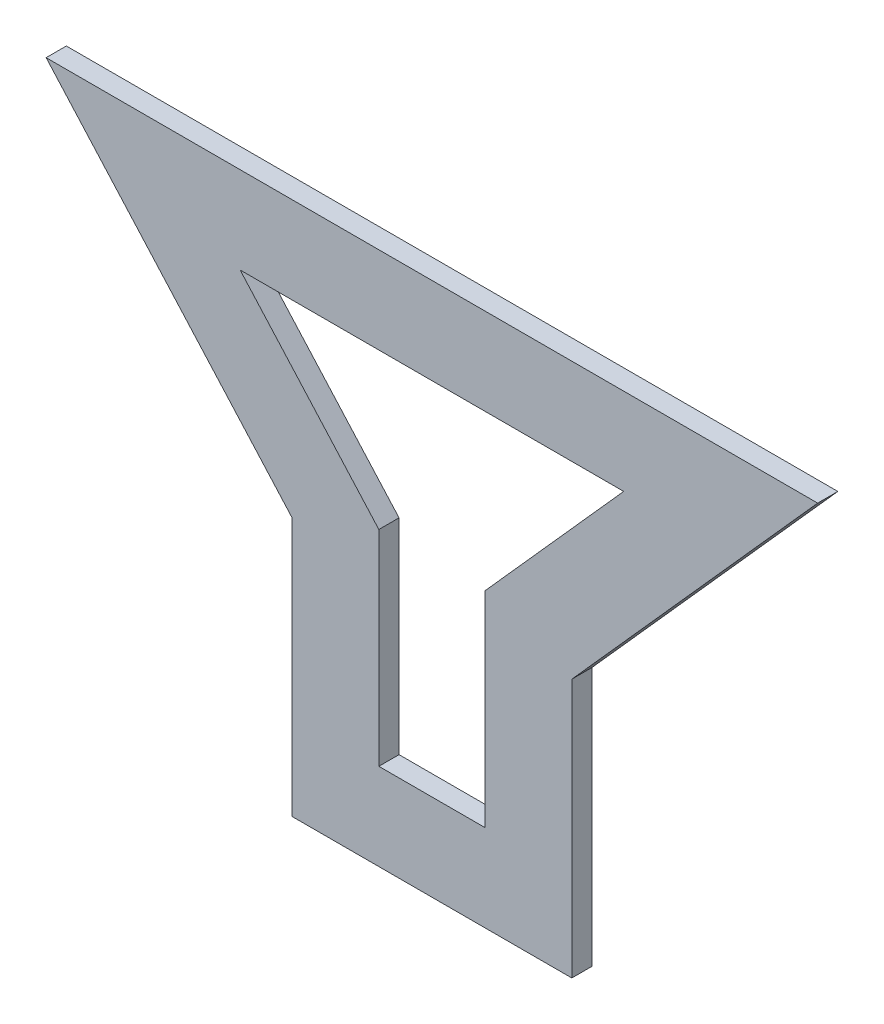
from build123d import *

# Parameters (mm, degrees)
EXTRUDE_2_DEPTH = 10


with BuildPart() as part:
    # Эскиз5 → Бобышка-Вытянуть2 (new body)
    with BuildSketch(Plane.XY):
        Polygon((69.270264014, 2.532805315), (69.270264014, -125.60178411), (-69.270264014, -125.60178411), (-69.270264014, 2.532805315), (-190.995381487, 138.884340659), (190.995381487, 138.884340659), align=None)
        Polygon((-26.270264014, -82.60178411), (26.270264014, -82.60178411), (26.270264014, 18.934099876), (94.96605886, 95.884340659), (-94.96605886, 95.884340659), (-26.270264014, 18.934099876), align=None, mode=Mode.SUBTRACT)
    extrude(amount=EXTRUDE_2_DEPTH)


solid = part.part
